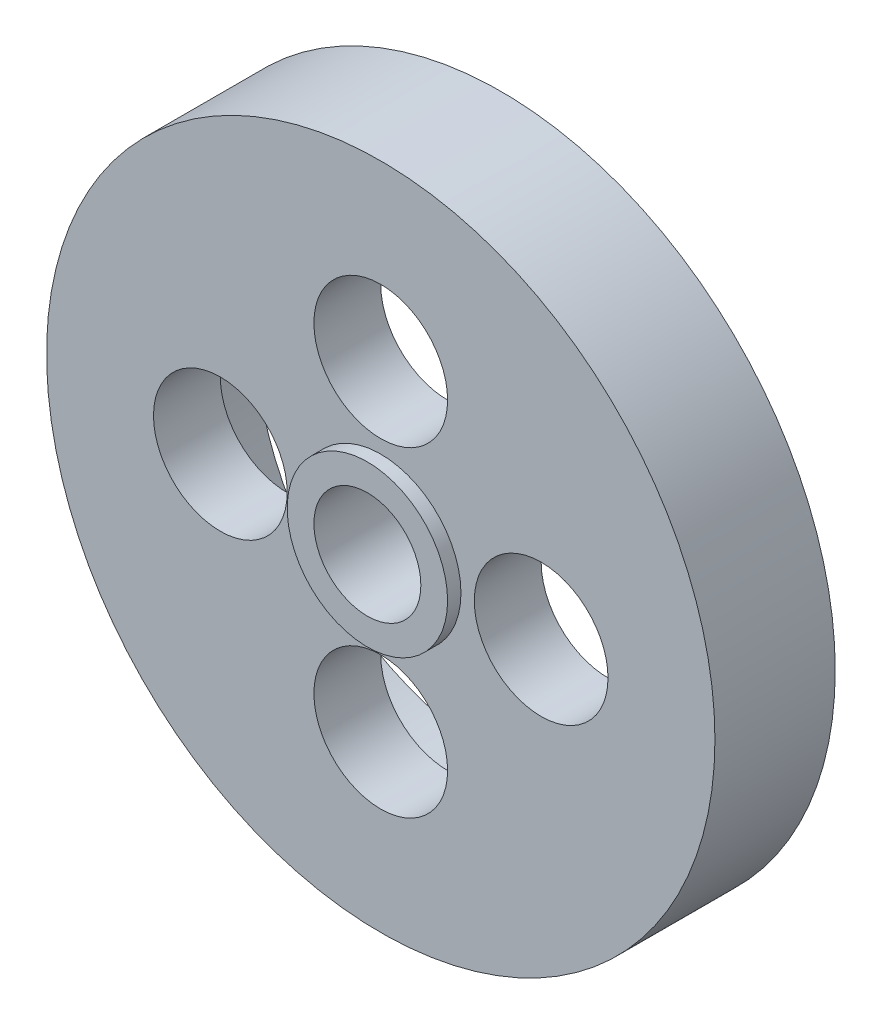
from build123d import *

# Parameters (mm, degrees)
SKETCH1_R           = 25
SKETCH1_R_2         = 5
SKETCH1_R_3         = 4
BOSS_EXTRUDE1_DEPTH = 9
SKETCH2_R           = 18
CUT_EXTRUDE1_DEPTH  = 4
SKETCH3_R           = 6
SKETCH3_R_2         = 4
BOSS_EXTRUDE2_DEPTH = 1
SCALE1_SCALE        = 1.5


with BuildPart() as part:
    # Sketch1 → Boss-Extrude1 (new body)
    with BuildSketch(Plane.XY):
        Circle(SKETCH1_R)
        with Locations((0, 12)):
            Circle(SKETCH1_R_2, mode=Mode.SUBTRACT)
        with Locations((12, 0)):
            Circle(SKETCH1_R_2, mode=Mode.SUBTRACT)
        with Locations((0, -12)):
            Circle(SKETCH1_R_2, mode=Mode.SUBTRACT)
        with Locations((-12, 0)):
            Circle(SKETCH1_R_2, mode=Mode.SUBTRACT)
        Circle(SKETCH1_R_3, mode=Mode.SUBTRACT)
    extrude(amount=BOSS_EXTRUDE1_DEPTH)

    # Sketch2 → Cut-Extrude1 (cut)
    with BuildSketch(Plane(origin=(0, 0, 0), x_dir=(-1, 0, 0), z_dir=(0, 0, -1))):
        Circle(SKETCH2_R)
    extrude(amount=-CUT_EXTRUDE1_DEPTH, mode=Mode.SUBTRACT)

    # Sketch3 → Boss-Extrude2 (add)
    with BuildSketch(Plane.XY.offset(9)):
        Circle(SKETCH3_R)
        with Locations(Location((0, 0, 0), (0, 0, 180))):
            Circle(SKETCH3_R_2, mode=Mode.SUBTRACT)
    extrude(amount=BOSS_EXTRUDE2_DEPTH)

    # Sketch4 → Cut-Revolve2 (revolve, cut)
    with BuildSketch(Plane(origin=(0, 0, 0), x_dir=(1, 0, 0), z_dir=(0, 1, 0))):
        Polygon((-25, 0), (0, -1.091523573), (0, 0), align=None)
    revolve(axis=Axis((0, 0, 1.091523573), (0, 0, -1)), mode=Mode.SUBTRACT)


with BuildPart() as part_1:
    # Scale1: scaled about (0, 0, 5.136545389)
    add(part.part.scale(SCALE1_SCALE).moved(Location((0, 0, -2.568272695))))


solid = part_1.part
